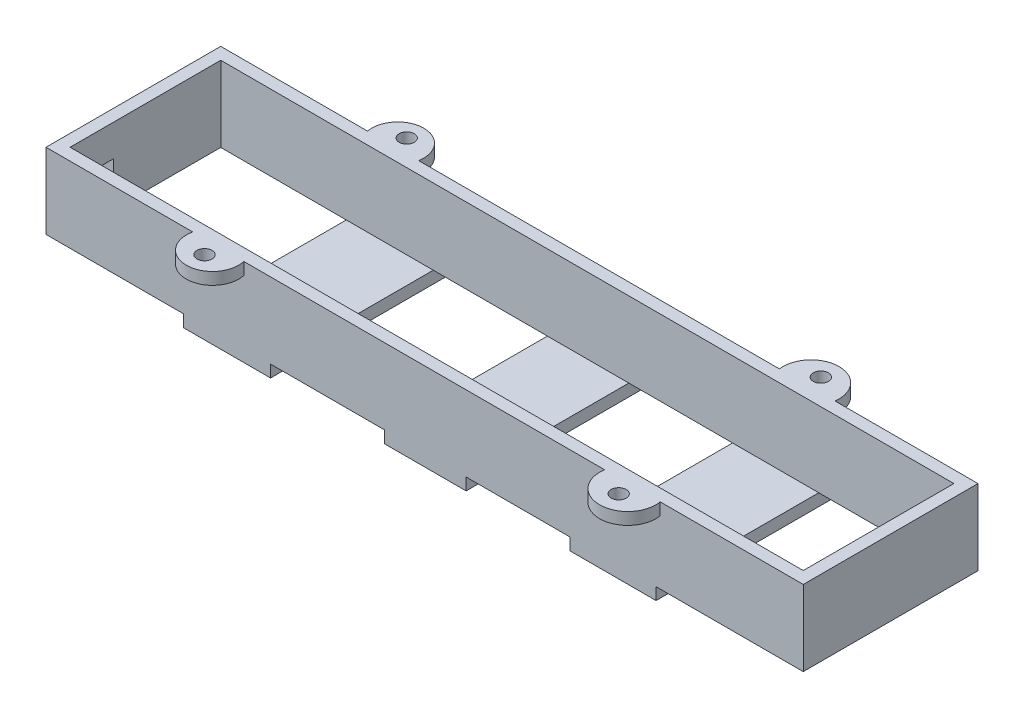
from build123d import *

# Parameters (mm, degrees)
SKETCH1_W           = 239.395
SKETCH1_H           = 55.245
SKETCH1_W_2         = 231.775
SKETCH1_H_2         = 47.625
BOSS_EXTRUDE1_DEPTH = 23.876
SKETCH2_W           = 27.501576043
SKETCH2_H           = 47.625
SKETCH2_W_2         = 27.249268006
SKETCH2_H_2         = 3.81
SKETCH2_W_3         = 25.735419783
SKETCH2_H_3         = 55.245
BOSS_EXTRUDE2_DEPTH = 3.81
SKETCH3_W           = 12.907242676
SKETCH3_H           = 13.858802321
CUT_EXTRUDE1_DEPTH  = 3.81
SKETCH4_R           = 2.38125
BOSS_EXTRUDE3_DEPTH = 3.81


with BuildPart() as part:
    # Sketch1 → Boss-Extrude1 (new body)
    with BuildSketch(Plane(origin=(0, 0, 0), x_dir=(1, 0, 0), z_dir=(0, 1, 0))):
        with Locations((62.882734648, -14.00661841)):
            Rectangle(SKETCH1_W, SKETCH1_H)
        with Locations((62.882734648, -14.00661841)):
            Rectangle(SKETCH1_W_2, SKETCH1_H_2, mode=Mode.SUBTRACT)
    extrude(amount=BOSS_EXTRUDE1_DEPTH)

    # Sketch2 → Boss-Extrude2 (add)
    with BuildSketch(Plane.XZ):
        with Locations((0.436495468, 14.00661841)):
            Rectangle(SKETCH2_W, SKETCH2_H)
        with Locations((122.427431402, 14.00661841)):
            Rectangle(SKETCH2_W_2, SKETCH2_H)
        with Locations((122.427431402, 39.72411841)):
            Rectangle(SKETCH2_W_2, SKETCH2_H_2)
        with Locations((0.436495468, 39.72411841)):
            Rectangle(SKETCH2_W, SKETCH2_H_2)
        with Locations((0.436495468, -11.71088159)):
            Rectangle(SKETCH2_W, SKETCH2_H_2)
        with Locations((122.427431402, -11.71088159)):
            Rectangle(SKETCH2_W_2, SKETCH2_H_2)
        with Locations((63.135042686, 14.00661841)):
            Rectangle(SKETCH2_W_3, SKETCH2_H_3)
    extrude(amount=BOSS_EXTRUDE2_DEPTH)

    # Sketch3 → Cut-Extrude1 (cut)
    with BuildSketch(Plane.ZY.offset(56.814765352)):
        with Locations((30.592232843, 6.929401161)):
            Rectangle(SKETCH3_W, SKETCH3_H)
    extrude(amount=-CUT_EXTRUDE1_DEPTH, mode=Mode.SUBTRACT)

    # Sketch4 → Boss-Extrude3 (add)
    # profile 1 of 4: a face of its own
    with BuildSketch(Plane(origin=(0, 23.876, 0), x_dir=(1, 0, 0), z_dir=(0, 1, 0))):
        with BuildLine():
            Line((-10.412074004, 13.61588159), (5.743340555, 13.61588159))
            ThreePointArc((5.743340555, 13.61588159), (-2.334366725, 23.314823136), (-10.412074004, 13.61588159))
        make_face()
        with Locations(Location((-2.334366725, 17.917758685, 0), (0, 0, 270))):
            Circle(SKETCH4_R, mode=Mode.SUBTRACT)
    # profile 2 of 4: a face of its own
    with BuildSketch(Plane(origin=(0, 23.876, 0), x_dir=(1, 0, 0), z_dir=(0, 1, 0))):
        with BuildLine():
            Line((-10.412074004, -41.62911841), (5.743340555, -41.62911841))
            ThreePointArc((5.743340555, -41.62911841), (-2.334366725, -51.744975779), (-10.412074004, -41.62911841))
        make_face()
        with Locations(Location((-2.334366725, -45.991983403, 0), (0, 0, 270))):
            Circle(SKETCH4_R, mode=Mode.SUBTRACT)
    # profile 3 of 4: a face of its own
    with BuildSketch(Plane(origin=(0, 23.876, 0), x_dir=(1, 0, 0), z_dir=(0, 1, 0))):
        with BuildLine():
            Line((119.805130889, -41.62911841), (137.369914175, -41.62911841))
            ThreePointArc((137.369914175, -41.62911841), (128.587522532, -52.012034088), (119.805130889, -41.62911841))
        make_face()
        with Locations(Location((128.587522532, -45.991983403, 0), (0, 0, 270))):
            Circle(SKETCH4_R, mode=Mode.SUBTRACT)
    # profile 4 of 4: a face of its own
    with BuildSketch(Plane(origin=(0, 23.876, 0), x_dir=(1, 0, 0), z_dir=(0, 1, 0))):
        with BuildLine():
            Line((119.805130889, 13.61588159), (137.369914175, 13.61588159))
            ThreePointArc((137.369914175, 13.61588159), (128.587522532, 23.697328425), (119.805130889, 13.61588159))
        make_face()
        with Locations(Location((128.587522532, 17.917758685, 0), (0, 0, 270))):
            Circle(SKETCH4_R, mode=Mode.SUBTRACT)
    extrude(amount=-BOSS_EXTRUDE3_DEPTH)


solid = part.part
